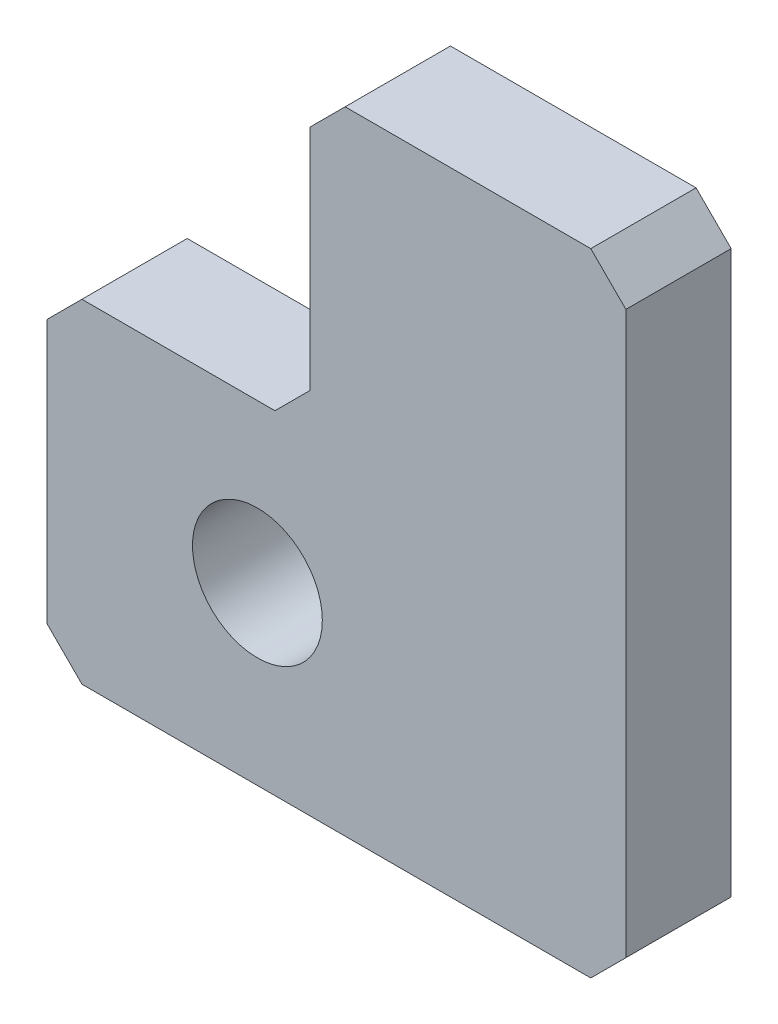
from build123d import *

# Parameters (mm, degrees)
BOSS_EXTRUDE3_DEPTH = 12
SKETCH5_W           = 3
SKETCH5_H           = 18
BOSS_EXTRUDE4_DEPTH = 4.5
CHAMFER1_SIZE       = 1
SKETCH4_R           = 1.85
CUT_EXTRUDE1_DEPTH  = 12


with BuildPart() as part:
    # Sketch3 → Boss-Extrude3 (new body)
    with BuildSketch(Plane.ZY.offset(178.52034041)):
        Polygon((-3, 14.684603209), (-5.250229512, 12.884419599), (-3, 11.084235989), (-3, 8.134419599), (0, 8.134419599), (0, 17.634419599), (-3, 17.634419599), align=None)
    extrude(amount=-BOSS_EXTRUDE3_DEPTH)

    # Sketch5 → Boss-Extrude4 (add, symmetric)
    with BuildSketch(Plane(origin=(-166.52034041, 0, 0), x_dir=(0, 0, -1), z_dir=(1, 0, 0))):
        with Locations((1.5, 17.134419599)):
            Rectangle(SKETCH5_W, SKETCH5_H)
    extrude(amount=BOSS_EXTRUDE4_DEPTH, both=True)

    # Chamfer1
    chamfer1_edges = [part.edges().sort_by_distance(p)[0] for p in [
        (-171.02034041, 17.634419599, -1.5),
        (-171.02034041, 26.134419599, -1.5),
        (-162.02034041, 8.134419599, -1.5),
        (-162.02034041, 26.134419599, -1.5),
        (-178.52034041, 17.634419599, -1.5),
        (-178.52034041, 8.134419599, -1.5),
    ]]
    chamfer(chamfer1_edges, length=CHAMFER1_SIZE)

    # Sketch4 → Cut-Extrude1 (cut)
    with BuildSketch(Plane.XY):
        with Locations((-172.52034041, 13.134419599)):
            Circle(SKETCH4_R)
    extrude(amount=-CUT_EXTRUDE1_DEPTH, mode=Mode.SUBTRACT)


solid = part.part
